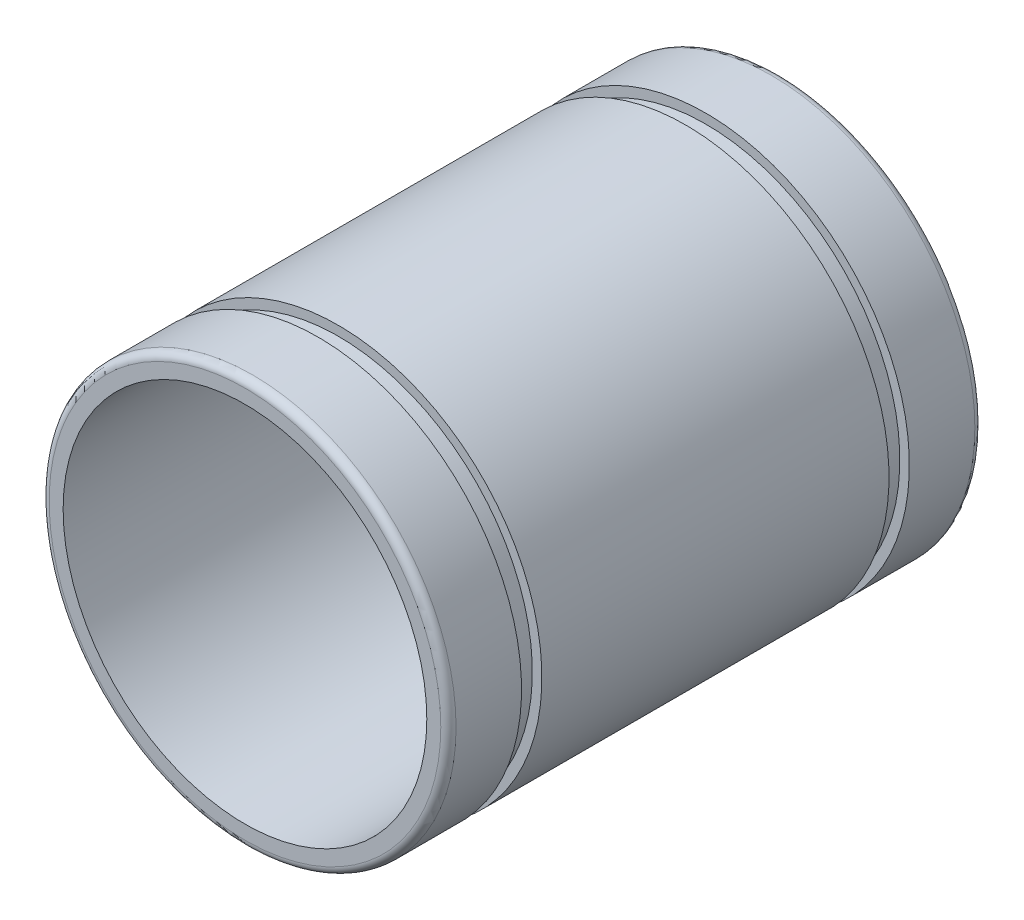
from build123d import *

# Parameters (mm, degrees)
SKETCH1_R           = 16
SKETCH1_R_2         = 14.3
BOSS_EXTRUDE1_DEPTH = 42
SKETCH3_W           = 0.75
SKETCH3_H           = 1.6
FILLET1_R           = 0.6


with BuildPart() as part:
    # Sketch1 → Boss-Extrude1 (new body)
    with BuildSketch(Plane.XY):
        with Locations(Location((0, 0, 0), (0, 0, 180))):
            Circle(SKETCH1_R)
        with Locations(Location((0, 0, 0), (0, 0, 180))):
            Circle(SKETCH1_R_2, mode=Mode.SUBTRACT)
    extrude(amount=BOSS_EXTRUDE1_DEPTH)

    # Sketch3 → Cut-Revolve2 (revolve, cut)
    with BuildSketch(Plane(origin=(0, 0, 0), x_dir=(1, 0, 0), z_dir=(0, 1, 0)), mode=Mode.PRIVATE) as cut_revolve2_sk:
        with Locations((15.625, -35.45)):
            Rectangle(SKETCH3_W, SKETCH3_H)
        with Locations((15.625, -6.55)):
            Rectangle(SKETCH3_W, SKETCH3_H)
    revolve(cut_revolve2_sk.sketch.rotate(Axis((0, 0, 0), (0, 0, 1)), 180), axis=Axis((0, 0, 0), (0, 0, 1)), mode=Mode.SUBTRACT)

    # Fillet1
    fillet1_edges = [part.edges().sort_by_distance(p)[0] for p in [
        (16, 0, 0),
        (16, 0, 42),
    ]]
    fillet(fillet1_edges, radius=FILLET1_R)


solid = part.part
